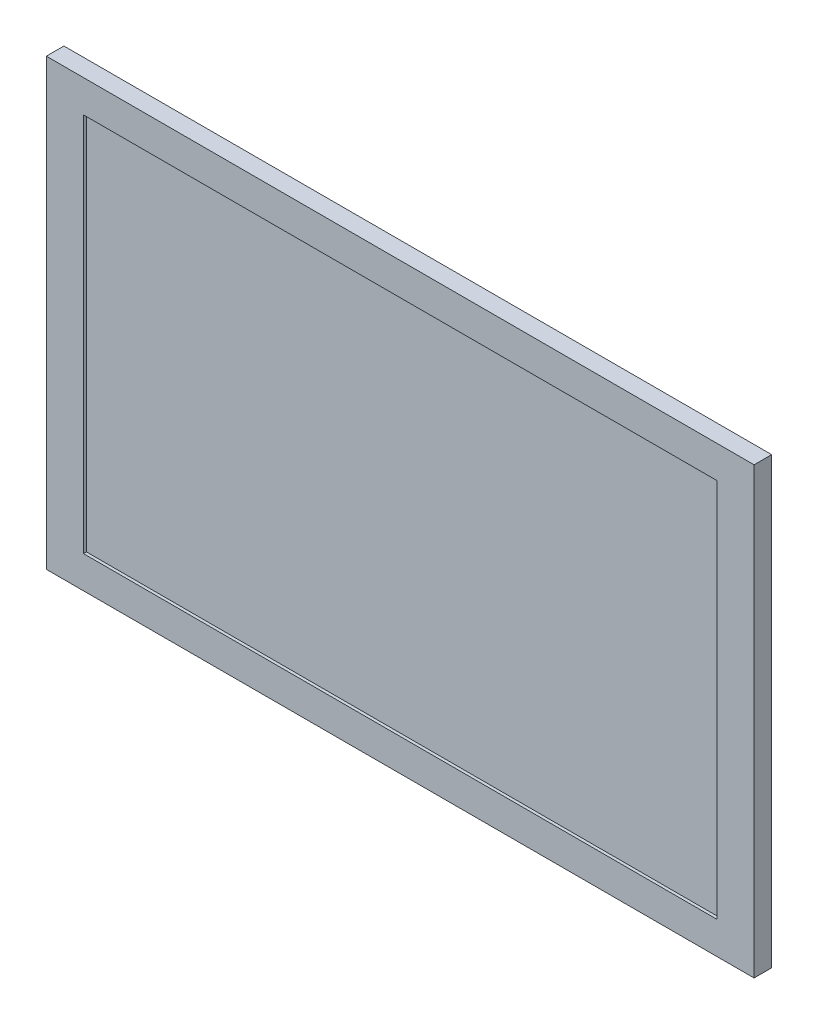
from build123d import *

# Parameters (mm, degrees)
SKETCH1_W           = 120.7
SKETCH1_H           = 75.8
BOSS_EXTRUDE1_DEPTH = 1.5
SKETCH2_W           = 108
SKETCH2_H           = 64.8
CUT_EXTRUDE1_DEPTH  = 0.5


with BuildPart() as part:
    # Sketch1 → Boss-Extrude1 (new, symmetric)
    with BuildSketch(Plane.XY):
        Rectangle(SKETCH1_W, SKETCH1_H)
    extrude(amount=BOSS_EXTRUDE1_DEPTH, both=True)

    # Sketch2 → Cut-Extrude1 (cut)
    with BuildSketch(Plane.XY.offset(1.5)):
        Rectangle(SKETCH2_W, SKETCH2_H)
    extrude(amount=-CUT_EXTRUDE1_DEPTH, mode=Mode.SUBTRACT)


solid = part.part
